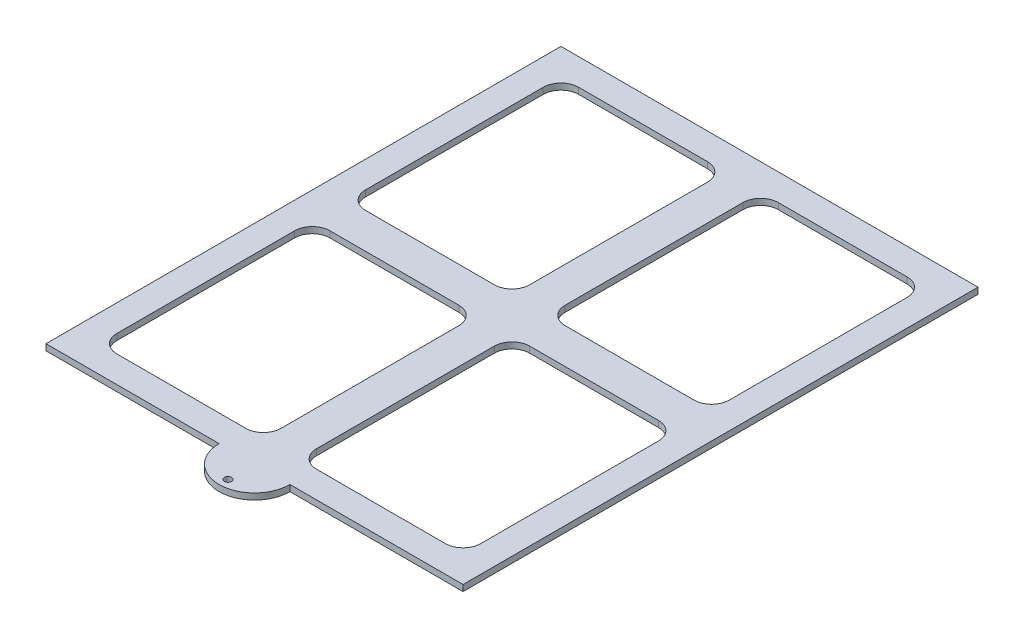
from build123d import *

# Parameters (mm, degrees)
SKETCH1_W           = 235.6
SKETCH1_H           = 290.9
BOSS_EXTRUDE1_DEPTH = 3.5
BOSS_EXTRUDE2_DEPTH = 3.5
SKETCH4_R           = 2
CUT_EXTRUDE1_DEPTH  = 3.5
SKETCH5_W           = 92.8
SKETCH5_H           = 120.45
CUT_EXTRUDE2_DEPTH  = 10
FILLET1_R           = 10


with BuildPart() as part:
    # Sketch1 → Boss-Extrude1 (new body)
    with BuildSketch(Plane(origin=(0, 0, 0), x_dir=(1, 0, 0), z_dir=(0, 1, 0))):
        Rectangle(SKETCH1_W, SKETCH1_H)
    extrude(amount=BOSS_EXTRUDE1_DEPTH)

    # Sketch3 → Boss-Extrude2 (add)
    with BuildSketch(Plane(origin=(0, 3.5, 0), x_dir=(1, 0, 0), z_dir=(0, 1, 0))):
        with BuildLine():
            Line((-20, -145.45), (20, -145.45))
            ThreePointArc((20, -145.45), (0, -165.45), (-20, -145.45))
        make_face()
    extrude(amount=-BOSS_EXTRUDE2_DEPTH)

    # Sketch4 → Cut-Extrude1 (cut)
    with BuildSketch(Plane(origin=(0, 3.5, 0), x_dir=(1, 0, 0), z_dir=(0, 1, 0))):
        with Locations(Location((0, -160.45, 0), (0, 0, 270))):
            Circle(SKETCH4_R)
    extrude(amount=-CUT_EXTRUDE1_DEPTH, mode=Mode.SUBTRACT)

    # Sketch5 → Cut-Extrude2 (cut)
    with BuildSketch(Plane(origin=(0, 3.5, 0), x_dir=(1, 0, 0), z_dir=(0, 1, 0))):
        with Locations((-56.4, 70.225)):
            Rectangle(SKETCH5_W, SKETCH5_H)
        with Locations((56.4, 70.225)):
            Rectangle(SKETCH5_W, SKETCH5_H)
        with Locations((-56.4, -70.225)):
            Rectangle(SKETCH5_W, SKETCH5_H)
        with Locations((56.4, -70.225)):
            Rectangle(SKETCH5_W, SKETCH5_H)
    extrude(amount=-CUT_EXTRUDE2_DEPTH, mode=Mode.SUBTRACT)

    # Fillet1
    fillet1_edges = [part.edges().sort_by_distance(p)[0] for p in [
        (10, 1.75, -10),
        (10, 1.75, -130.45),
        (102.8, 1.75, -130.45),
        (102.8, 1.75, -10),
        (-102.8, 1.75, 130.45),
        (-102.8, 1.75, 10),
        (-10, 1.75, 10),
        (-10, 1.75, 130.45),
        (10, 1.75, 130.45),
        (10, 1.75, 10),
        (102.8, 1.75, 10),
        (102.8, 1.75, 130.45),
        (-102.8, 1.75, -10),
        (-102.8, 1.75, -130.45),
        (-10, 1.75, -130.45),
        (-10, 1.75, -10),
    ]]
    fillet(fillet1_edges, radius=FILLET1_R)


solid = part.part
